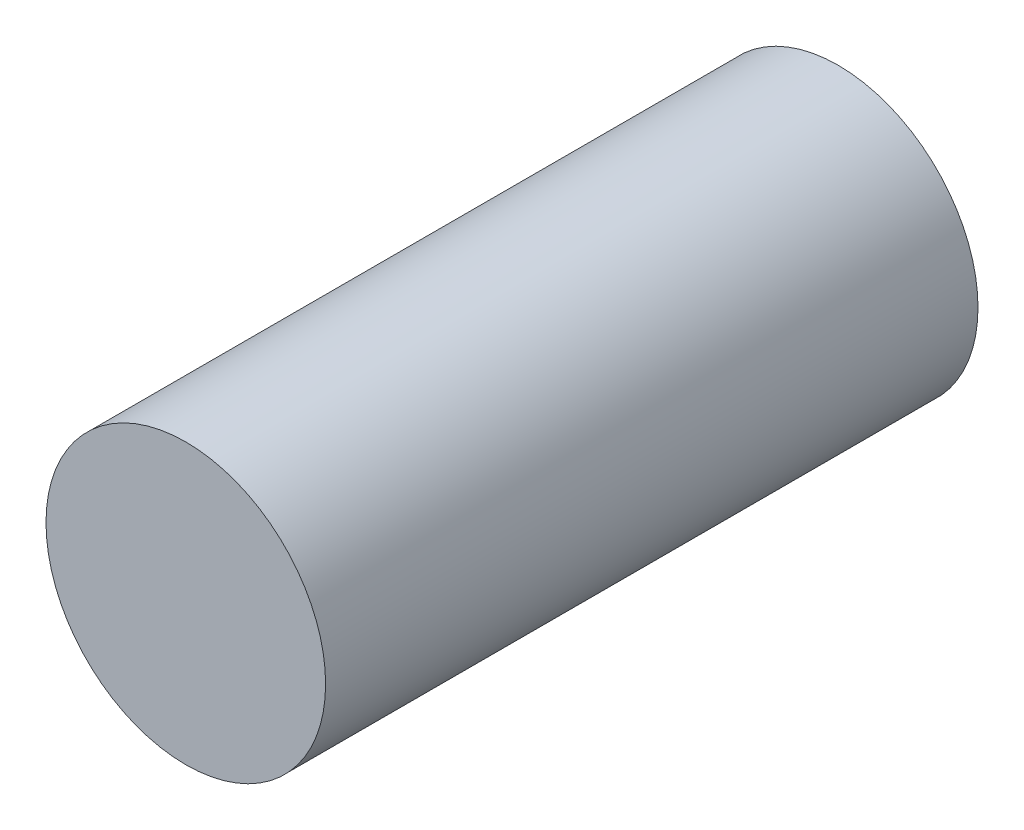
from build123d import *

# Parameters (mm, degrees)
CROQUIS1_R              = 3
SALIENTE_EXTRUIR1_DEPTH = 14


with BuildPart() as part:
    # Croquis1 → Saliente-Extruir1 (new body)
    with BuildSketch(Plane.XY):
        Circle(CROQUIS1_R)
    extrude(amount=SALIENTE_EXTRUIR1_DEPTH)


solid = part.part
